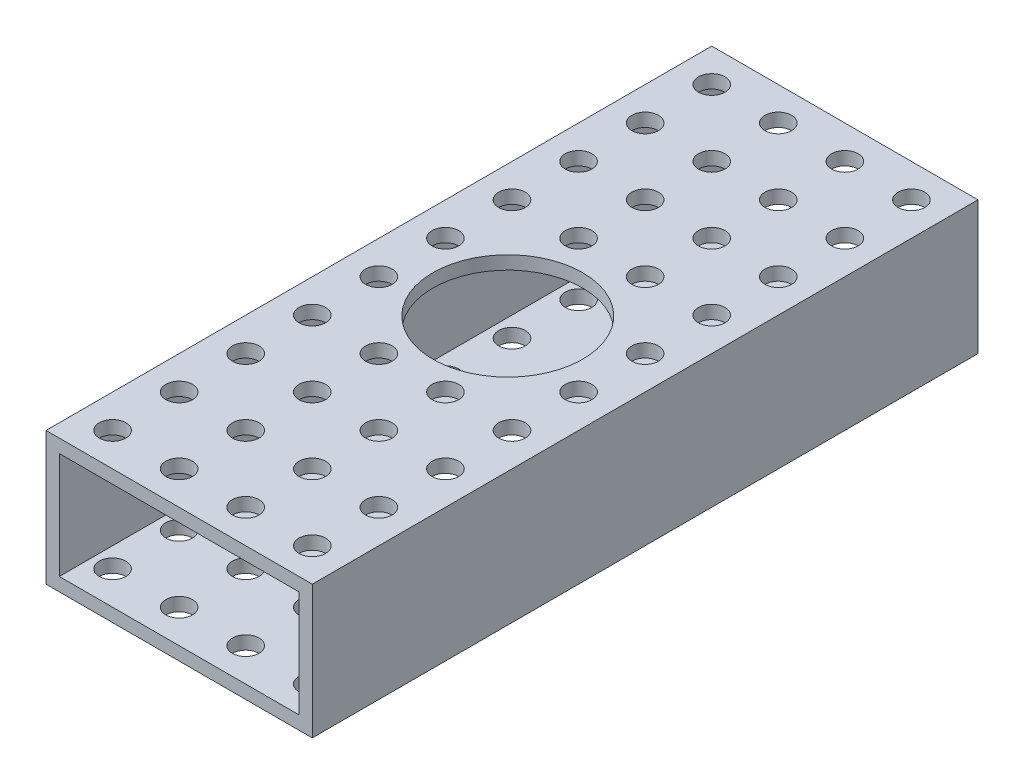
from build123d import *

# Parameters (mm, degrees)
SKETCH1_W           = 50.8
SKETCH1_H           = 25.4
SKETCH1_W_2         = 45.72
SKETCH1_H_2         = 20.32
BOSS_EXTRUDE1_DEPTH = 127
SKETCH2_R           = 2.54
CUT_EXTRUDE1_DEPTH  = 25.4
SKETCH3_R           = 14.3002
CUT_EXTRUDE2_DEPTH  = 25.4


with BuildPart() as part:
    # Sketch1 → Boss-Extrude1 (new body)
    with BuildSketch(Plane.XY):
        with Locations((-75.184, 73.640461538)):
            Rectangle(SKETCH1_W, SKETCH1_H)
        with Locations((-75.184, 73.640461538)):
            Rectangle(SKETCH1_W_2, SKETCH1_H_2, mode=Mode.SUBTRACT)
    extrude(amount=BOSS_EXTRUDE1_DEPTH)

    # Sketch2 → Cut-Extrude1 (cut)
    with BuildSketch(Plane(origin=(0, 86.340461538, 0), x_dir=(1, 0, 0), z_dir=(0, 1, 0))):
        with Locations(Location((-94.234, -6.35, 0), (0, 0, 180))):
            Circle(SKETCH2_R)
        with Locations(Location((-81.534, -6.35, 0), (0, 0, 180))):
            Circle(SKETCH2_R)
        with Locations(Location((-68.834, -6.35, 0), (0, 0, 180))):
            Circle(SKETCH2_R)
        with Locations(Location((-56.134, -6.35, 0), (0, 0, 180))):
            Circle(SKETCH2_R)
        with Locations(Location((-81.534, -19.05, 0), (0, 0, 180))):
            Circle(SKETCH2_R)
        with Locations(Location((-68.834, -19.05, 0), (0, 0, 180))):
            Circle(SKETCH2_R)
        with Locations(Location((-56.134, -19.05, 0), (0, 0, 180))):
            Circle(SKETCH2_R)
        with Locations(Location((-81.534, -31.75, 0), (0, 0, 180))):
            Circle(SKETCH2_R)
        with Locations(Location((-68.834, -31.75, 0), (0, 0, 180))):
            Circle(SKETCH2_R)
        with Locations(Location((-56.134, -31.75, 0), (0, 0, 180))):
            Circle(SKETCH2_R)
        with Locations(Location((-81.534, -44.45, 0), (0, 0, 180))):
            Circle(SKETCH2_R)
        with Locations(Location((-68.834, -44.45, 0), (0, 0, 180))):
            Circle(SKETCH2_R)
        with Locations(Location((-56.134, -44.45, 0), (0, 0, 180))):
            Circle(SKETCH2_R)
        with Locations(Location((-81.534, -57.15, 0), (0, 0, 180))):
            Circle(SKETCH2_R)
        with Locations(Location((-68.834, -57.15, 0), (0, 0, 180))):
            Circle(SKETCH2_R)
        with Locations(Location((-56.134, -57.15, 0), (0, 0, 180))):
            Circle(SKETCH2_R)
        with Locations(Location((-81.534, -69.85, 0), (0, 0, 180))):
            Circle(SKETCH2_R)
        with Locations(Location((-68.834, -69.85, 0), (0, 0, 180))):
            Circle(SKETCH2_R)
        with Locations(Location((-56.134, -69.85, 0), (0, 0, 180))):
            Circle(SKETCH2_R)
        with Locations(Location((-81.534, -82.55, 0), (0, 0, 180))):
            Circle(SKETCH2_R)
        with Locations(Location((-68.834, -82.55, 0), (0, 0, 180))):
            Circle(SKETCH2_R)
        with Locations(Location((-56.134, -82.55, 0), (0, 0, 180))):
            Circle(SKETCH2_R)
        with Locations(Location((-81.534, -95.25, 0), (0, 0, 180))):
            Circle(SKETCH2_R)
        with Locations(Location((-68.834, -95.25, 0), (0, 0, 180))):
            Circle(SKETCH2_R)
        with Locations(Location((-56.134, -95.25, 0), (0, 0, 180))):
            Circle(SKETCH2_R)
        with Locations(Location((-81.534, -107.95, 0), (0, 0, 180))):
            Circle(SKETCH2_R)
        with Locations(Location((-68.834, -107.95, 0), (0, 0, 180))):
            Circle(SKETCH2_R)
        with Locations(Location((-56.134, -107.95, 0), (0, 0, 180))):
            Circle(SKETCH2_R)
        with Locations(Location((-81.534, -120.65, 0), (0, 0, 180))):
            Circle(SKETCH2_R)
        with Locations(Location((-68.834, -120.65, 0), (0, 0, 180))):
            Circle(SKETCH2_R)
        with Locations(Location((-56.134, -120.65, 0), (0, 0, 180))):
            Circle(SKETCH2_R)
        with Locations(Location((-94.234, -19.05, 0), (0, 0, 180))):
            Circle(SKETCH2_R)
        with Locations(Location((-94.234, -31.75, 0), (0, 0, 180))):
            Circle(SKETCH2_R)
        with Locations(Location((-94.234, -44.45, 0), (0, 0, 180))):
            Circle(SKETCH2_R)
        with Locations(Location((-94.234, -57.15, 0), (0, 0, 180))):
            Circle(SKETCH2_R)
        with Locations(Location((-94.234, -69.85, 0), (0, 0, 180))):
            Circle(SKETCH2_R)
        with Locations(Location((-94.234, -82.55, 0), (0, 0, 180))):
            Circle(SKETCH2_R)
        with Locations(Location((-94.234, -95.25, 0), (0, 0, 180))):
            Circle(SKETCH2_R)
        with Locations(Location((-94.234, -107.95, 0), (0, 0, 180))):
            Circle(SKETCH2_R)
        with Locations(Location((-94.234, -120.65, 0), (0, 0, 180))):
            Circle(SKETCH2_R)
    extrude(amount=-CUT_EXTRUDE1_DEPTH, mode=Mode.SUBTRACT)

    # Sketch3 → Cut-Extrude2 (cut)
    with BuildSketch(Plane.XZ.offset(-60.940461538)):
        with Locations(Location((-75.450612599, 64.036338499, 0), (0, 0, 270))):
            Circle(SKETCH3_R)
    extrude(amount=-CUT_EXTRUDE2_DEPTH, mode=Mode.SUBTRACT)


solid = part.part
